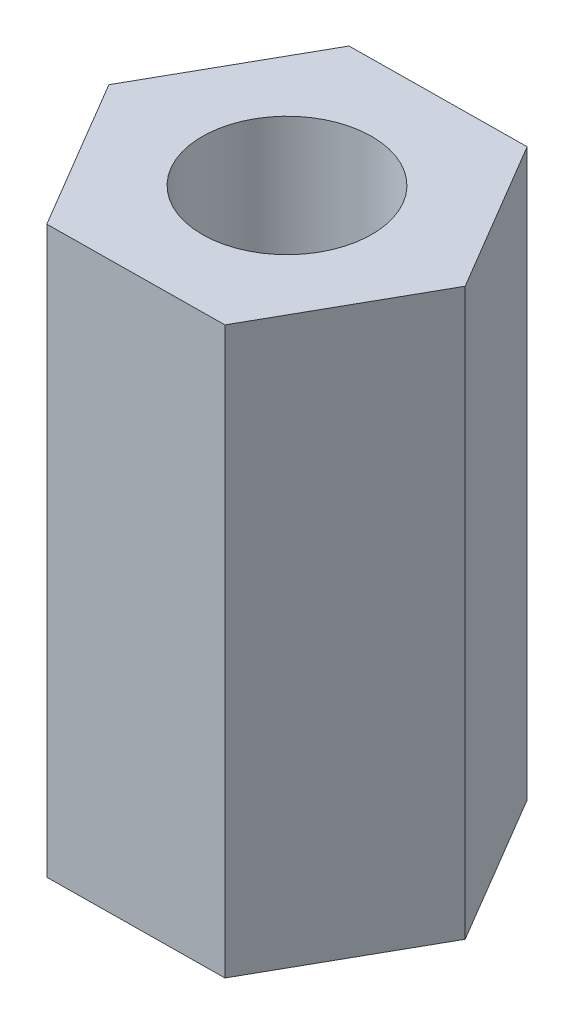
from build123d import *

# Parameters (mm, degrees)
BOSS_EXTRUDE1_DEPTH       = 10
F_3_0MM_DOWEL_HOLE1_D     = 3
F_3_0MM_DOWEL_HOLE1_DEPTH = 25.4
F_3_0MM_DOWEL_HOLE1_TIP   = 0.901290929


with BuildPart() as part:
    # Sketch1 → Boss-Extrude1 (new body)
    with BuildSketch(Plane(origin=(0, 0, 0), x_dir=(1, 0, 0), z_dir=(0, 1, 0))):
        Polygon((-1.586847165, 2.683638589), (-3.117522775, -0.032430663), (-1.53067561, -2.716069251), (1.586847165, -2.683638589), (3.117522775, 0.032430663), (1.53067561, 2.716069251), align=None)
    extrude(amount=BOSS_EXTRUDE1_DEPTH)

    # Ø3.0mm Dowel Hole1
    with Locations(Plane(origin=(0, 10, 0), x_dir=(1, 0, 0), z_dir=(0, 1, 0))):
        with Locations((0, 0)):
            Hole(F_3_0MM_DOWEL_HOLE1_D / 2, depth=F_3_0MM_DOWEL_HOLE1_DEPTH)
            with Locations((0, 0, -(F_3_0MM_DOWEL_HOLE1_DEPTH + F_3_0MM_DOWEL_HOLE1_TIP / 2))):  # 118° drill point
                Cone(0, F_3_0MM_DOWEL_HOLE1_D / 2, F_3_0MM_DOWEL_HOLE1_TIP, mode=Mode.SUBTRACT)


solid = part.part
